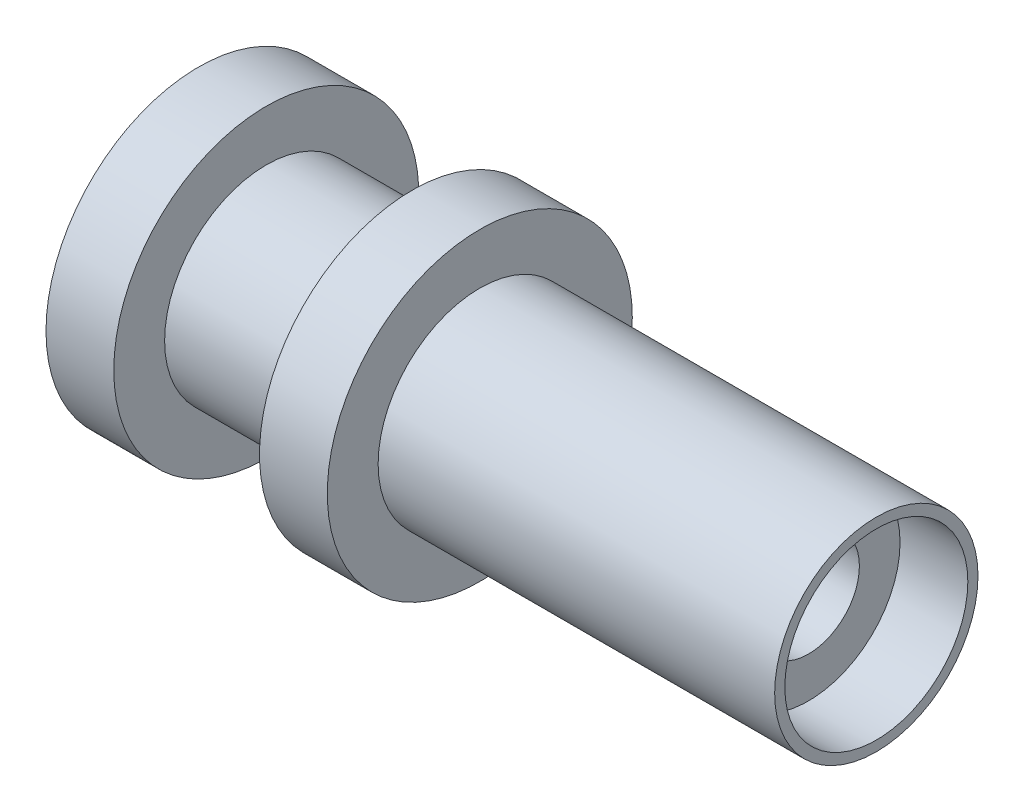
from build123d import *

# Parameters (mm, degrees)
SKETCH1_R               = 3
BOSS_EXTRUDE1_DEPTH     = 18
SKETCH2_R               = 2.7
CUT_EXTRUDE1_DEPTH      = 2
CUT_EXTRUDE2_DEPTH      = 17.552945357
CUT_EXTRUDE2_DEPTH_BACK = 17.552945357
SKETCH3_R               = 1.5
SKETCH4_R               = 4.5
BOSS_EXTRUDE2_DEPTH     = 2
BOSS_EXTRUDE3_START     = -6.3
SKETCH4_3_R             = 4.5
BOSS_EXTRUDE3_DEPTH     = 2
CUT_EXTRUDE3_DEPTH      = 21.988091862
CUT_EXTRUDE3_DEPTH_BACK = 21.988091862
SKETCH5_R               = 1.5
CUT_EXTRUDE4_DEPTH      = 21.988091862
CUT_EXTRUDE4_DEPTH_BACK = 1


with BuildPart() as part:
    # Sketch1 → Boss-Extrude1 (new body)
    with BuildSketch(Plane(origin=(0, 0, 0), x_dir=(0, 0, -1), z_dir=(1, 0, 0))):
        Circle(SKETCH1_R)
    extrude(amount=BOSS_EXTRUDE1_DEPTH)

    # Sketch2 → Cut-Extrude1 (cut)
    with BuildSketch(Plane(origin=(18, 0, 0), x_dir=(0, 0, -1), z_dir=(1, 0, 0))):
        Circle(SKETCH2_R)
    extrude(amount=-CUT_EXTRUDE1_DEPTH, mode=Mode.SUBTRACT)

    # Sketch3 → Cut-Extrude2 (cut, two sides: drawn at the far end of the back side and taken through both)
    with BuildSketch(Plane(origin=(16, 0, 0), x_dir=(0, 0, -1), z_dir=(1, 0, 0)).offset(-CUT_EXTRUDE2_DEPTH_BACK)):
        Circle(SKETCH3_R)
    extrude(amount=CUT_EXTRUDE2_DEPTH + CUT_EXTRUDE2_DEPTH_BACK, mode=Mode.SUBTRACT)

    # Sketch4 → Boss-Extrude2 (add)
    with BuildSketch(Plane.ZY):
        Circle(SKETCH4_R)
    extrude(amount=BOSS_EXTRUDE2_DEPTH)

    # Sketch4<3> → Boss-Extrude3 (add)
    with BuildSketch(Plane.ZY.offset(BOSS_EXTRUDE3_START)):
        Circle(SKETCH4_3_R)
    extrude(amount=BOSS_EXTRUDE3_DEPTH)

    # Sketch5 → Cut-Extrude3 (cut, two sides: drawn at the far end of the back side and taken through both)
    with BuildSketch(Plane.ZY.offset(2).offset(-CUT_EXTRUDE3_DEPTH_BACK)):
        with Locations(Location((0, 0, 0), (0, 0, 180))):
            Circle(SKETCH5_R)
    extrude(amount=CUT_EXTRUDE3_DEPTH + CUT_EXTRUDE3_DEPTH_BACK, mode=Mode.SUBTRACT)

    # Sketch6 → Cut-Extrude4 (cut, two sides: drawn at the far end of the back side and taken through both)
    with BuildSketch(Plane.ZY.offset(2).offset(-CUT_EXTRUDE4_DEPTH_BACK)):
        Polygon((2.8, -1.616580754), (2.8, 1.616580754), (0, 3.233161507), (-2.8, 1.616580754), (-2.8, -1.616580754), (0, -3.233161507), align=None)
    extrude(amount=CUT_EXTRUDE4_DEPTH + CUT_EXTRUDE4_DEPTH_BACK, mode=Mode.SUBTRACT)


solid = part.part
